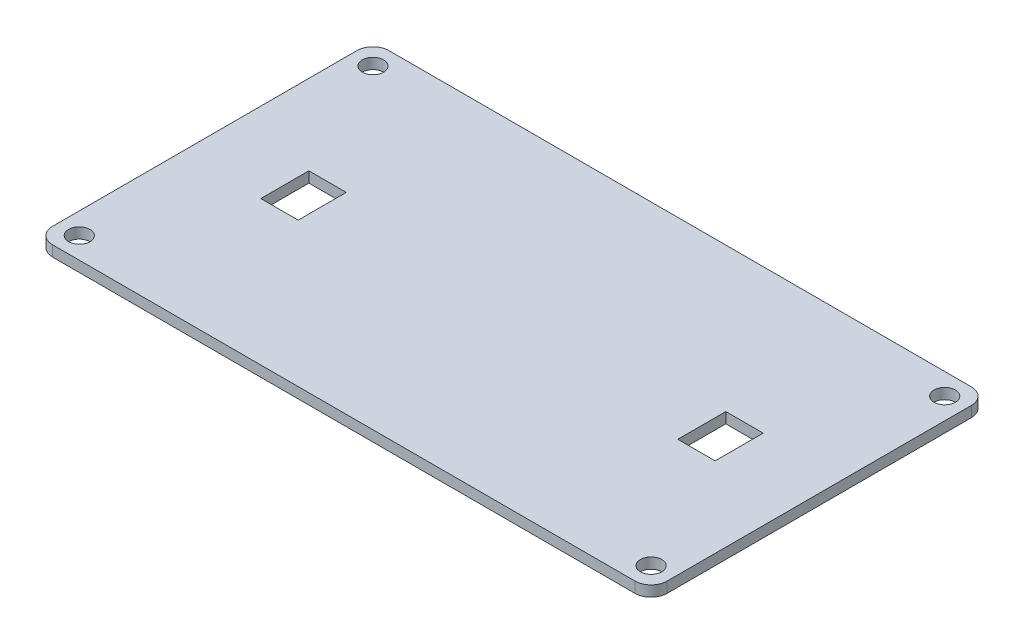
from build123d import *

# Parameters (mm, degrees)
ESBO_O1_W                  = 115.09677689
ESBO_O1_H                  = 63
RESSALTO_EXTRUS_O1_DEPTH   = 2
ESBO_O5_R                  = 2
CORTE_EXTRUS_O3_DEPTH      = 66.635866816
FILETE1_R                  = 3
CORTE_EXTRUS_O4_DEPTH      = 66.635866816
CORTE_EXTRUS_O4_DEPTH_BACK = 66.635866816
ESBO_O6_W                  = 7
ESBO_O6_H                  = 9


with BuildPart() as part:
    # Esboço1 → Ressalto-extrusão1 (new body)
    with BuildSketch(Plane(origin=(0, 0, 0), x_dir=(1, 0, 0), z_dir=(0, 1, 0))):
        Rectangle(ESBO_O1_W, ESBO_O1_H)
    extrude(amount=RESSALTO_EXTRUS_O1_DEPTH)

    # Esboço5 → Corte-extrusão3 (cut, through all)
    with BuildSketch(Plane(origin=(0, 2, 0), x_dir=(1, 0, 0), z_dir=(0, 1, 0))):
        with Locations(Location((53.548388445, 27.5, 0), (0, 0, 270))):
            Circle(ESBO_O5_R)
        with Locations(Location((53.548388445, -27.5, 0), (0, 0, 90))):
            Circle(ESBO_O5_R)
        with Locations(Location((-53.548388445, -27.5, 0), (0, 0, 270))):
            Circle(ESBO_O5_R)
        with Locations(Location((-53.548388445, 27.5, 0), (0, 0, 90))):
            Circle(ESBO_O5_R)
    extrude(amount=-CORTE_EXTRUS_O3_DEPTH, mode=Mode.SUBTRACT)

    # Filete1
    filete1_edges = [part.edges().sort_by_distance(p)[0] for p in [
        (-57.548388445, 1, -31.5),
        (57.548388445, 1, -31.5),
        (57.548388445, 1, 31.5),
        (-57.548388445, 1, 31.5),
    ]]
    fillet(filete1_edges, radius=FILETE1_R)

    # Esboço6 → Corte-extrusão4 (cut, two sides: drawn at the far end of the back side and taken through both)
    with BuildSketch(Plane(origin=(0, 2, 0), x_dir=(1, 0, 0), z_dir=(0, 1, 0)).offset(-CORTE_EXTRUS_O4_DEPTH_BACK)):
        with Locations((-39.048388445, 0)):
            Rectangle(ESBO_O6_W, ESBO_O6_H)
        with Locations((39.048388445, 0)):
            Rectangle(ESBO_O6_W, ESBO_O6_H)
    extrude(amount=CORTE_EXTRUS_O4_DEPTH + CORTE_EXTRUS_O4_DEPTH_BACK, mode=Mode.SUBTRACT)


solid = part.part
